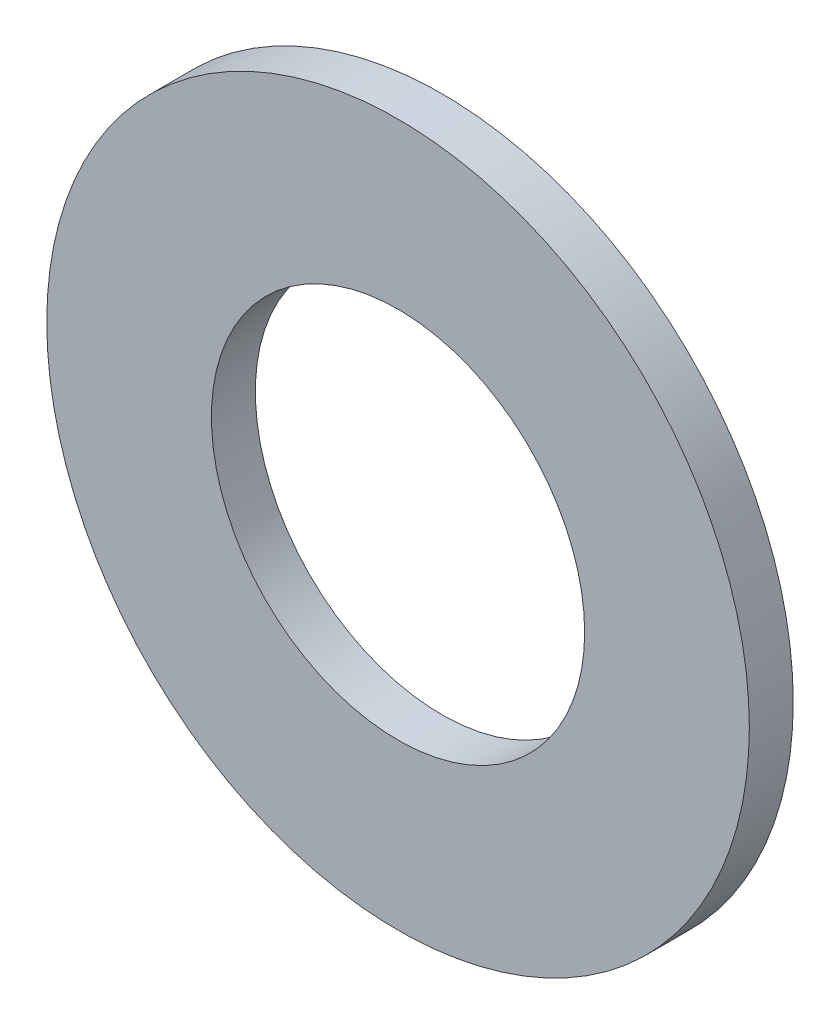
from build123d import *

# Parameters (mm, degrees)
ESQUISSE1_R        = 8
ESQUISSE1_R_2      = 4.25
BOSS_EXTRU_1_DEPTH = 1


with BuildPart() as part:
    # Esquisse1 → Boss.-Extru.1 (new body)
    with BuildSketch(Plane.XY):
        Circle(ESQUISSE1_R)
        Circle(ESQUISSE1_R_2, mode=Mode.SUBTRACT)
    extrude(amount=BOSS_EXTRU_1_DEPTH)


solid = part.part
